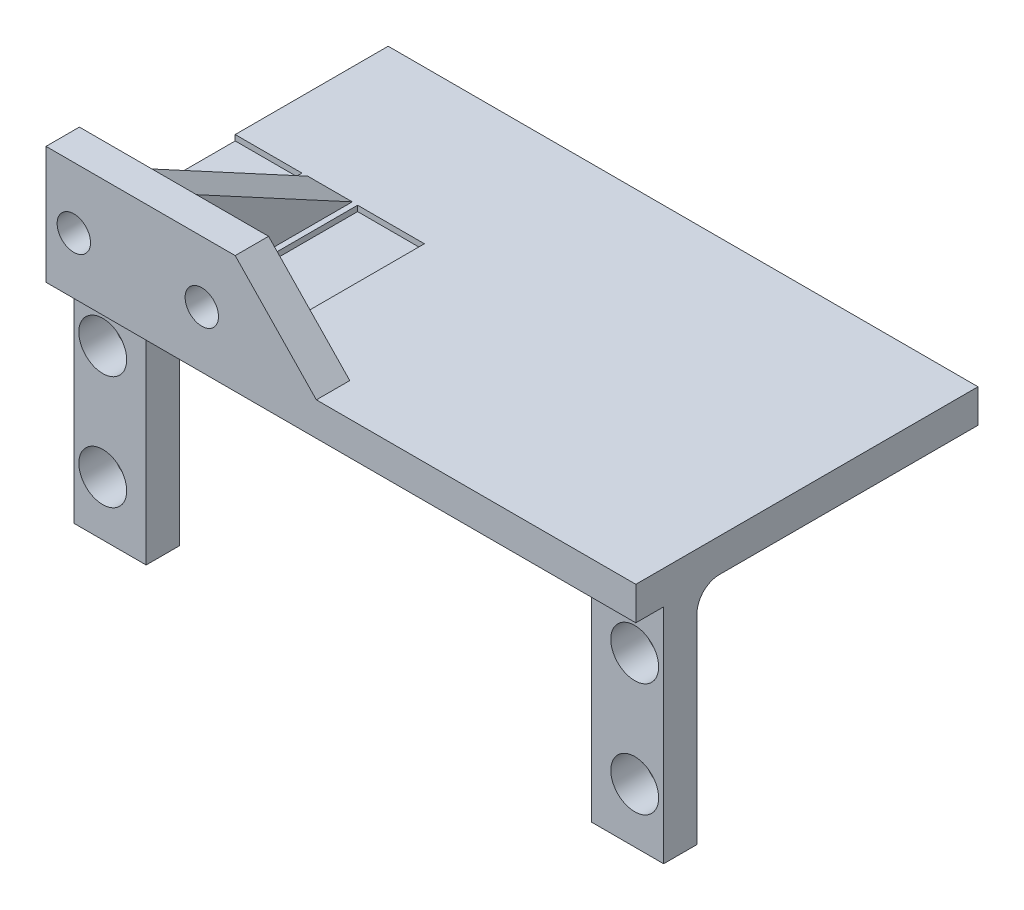
from build123d import *

# Parameters (mm, degrees)
SKETCH1_W                = 53
SKETCH1_H                = 30.745586227
BOSS_EXTRUDE1_DEPTH      = 3
SKETCH2_W                = 6.5
SKETCH2_H                = 3
BOSS_EXTRUDE2_DEPTH      = 20
SKETCH3_R                = 2.15
CUT_EXTRUDE1_DEPTH       = 3
SKETCH6_W                = 17
SKETCH6_H                = 7.58
BOSS_EXTRUDE3_DEPTH      = 3
SKETCH7_R                = 1.5
CUT_EXTRUDE2_DEPTH       = 7.5
SKETCH8_W                = 6
SKETCH8_H                = 14
CUT_EXTRUDE3_DEPTH       = 0.5
FILLET1_R                = 2
BOSS_EXTRUDE4_DEPTH      = 2
BOSS_EXTRUDE4_DEPTH_BACK = 2
BOSS_EXTRUDE5_DEPTH      = 3


with BuildPart() as part:
    # Sketch1 → Boss-Extrude1 (new body)
    with BuildSketch(Plane(origin=(0, 0, 0), x_dir=(1, 0, 0), z_dir=(0, 1, 0))):
        with Locations((24.118089155, -22.118099476)):
            Rectangle(SKETCH1_W, SKETCH1_H)
    extrude(amount=BOSS_EXTRUDE1_DEPTH)

    # Sketch2 → Boss-Extrude2 (add)
    with BuildSketch(Plane.XZ):
        with Locations((47.368089155, 33.49089259)):
            Rectangle(SKETCH2_W, SKETCH2_H)
        with Locations((0.868089155, 33.49089259)):
            Rectangle(SKETCH2_W, SKETCH2_H)
    extrude(amount=BOSS_EXTRUDE2_DEPTH)

    # Sketch3 → Cut-Extrude1 (cut)
    with BuildSketch(Plane.XY.offset(34.99089259)):
        with Locations((48.018089155, -15.1)):
            Circle(SKETCH3_R)
        with Locations((48.018089155, -4.9)):
            Circle(SKETCH3_R)
        with Locations((0.218089155, -15.1)):
            Circle(SKETCH3_R)
        with Locations((0.218089155, -4.9)):
            Circle(SKETCH3_R)
    extrude(amount=-CUT_EXTRUDE1_DEPTH, mode=Mode.SUBTRACT)

    # Sketch6 → Boss-Extrude3 (add)
    with BuildSketch(Plane.XY.offset(37.49089259)):
        with Locations((6.118089155, 6.79)):
            Rectangle(SKETCH6_W, SKETCH6_H)
    extrude(amount=-BOSS_EXTRUDE3_DEPTH)

    # Sketch7 → Cut-Extrude2 (cut)
    with BuildSketch(Plane.XY.offset(37.49089259)):
        with Locations((0.118089155, 5.081241932)):
            Circle(SKETCH7_R)
        with Locations((11.618089155, 5.081241932)):
            Circle(SKETCH7_R)
    extrude(amount=-CUT_EXTRUDE2_DEPTH, mode=Mode.SUBTRACT)

    # Sketch8 → Cut-Extrude3 (cut)
    with BuildSketch(Plane(origin=(0, 3, 0), x_dir=(1, 0, 0), z_dir=(0, 1, 0))):
        with Locations((11.618089155, -27.49089259)):
            Rectangle(SKETCH8_W, SKETCH8_H)
        with Locations((0.618089155, -27.49089259)):
            Rectangle(SKETCH8_W, SKETCH8_H)
    extrude(amount=-CUT_EXTRUDE3_DEPTH, mode=Mode.SUBTRACT)

    # Fillet1
    fillet1_edges = [part.edges().sort_by_distance(p)[0] for p in [
        (47.368089155, 0, 31.99089259),
        (0.868089155, 0, 31.99089259),
    ]]
    fillet(fillet1_edges, radius=FILLET1_R)

    # Sketch13 → Boss-Extrude4 (add, two sides: drawn at the far end of the back side and taken through both)
    with BuildSketch(Plane.ZY.offset(-6.118089155).offset(-BOSS_EXTRUDE4_DEPTH_BACK)):
        Polygon((34.49089259, 10.57033397), (34.49089259, 3), (20.468920989, 3), align=None)
    extrude(amount=BOSS_EXTRUDE4_DEPTH + BOSS_EXTRUDE4_DEPTH_BACK)

    # Sketch14 → Boss-Extrude5 (add)
    with BuildSketch(Plane.XY.offset(37.49089259)):
        Polygon((14.618089155, 3), (14.618089155, 10.58), (21.91210821, 3), align=None)
    extrude(amount=-BOSS_EXTRUDE5_DEPTH)


solid = part.part
